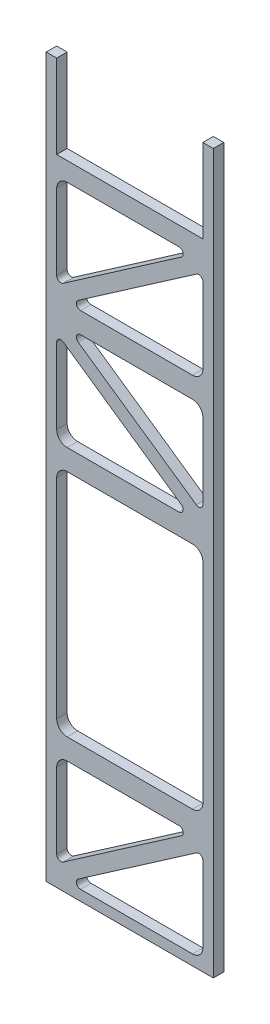
from build123d import *

# Parameters (mm, degrees)
BOSS_EXTRUDE1_DEPTH = 6.35
CUT_EXTRUDE1_START  = -6.35
CUT_EXTRUDE1_DEPTH  = 6.35


with BuildPart() as part:
    # Model → Boss-Extrude1 (new body)
    with BuildSketch(Plane.XY):
        Polygon((-95.25, 386.08), (-6.35, 386.08), (-6.35, 436.88), (0, 436.88), (0, 0), (-101.6, 0), (-101.6, 436.88), (-95.25, 436.88), align=None)
        with BuildLine():
            Line((-80.76878597, 311.15), (-12.7, 311.15))
            ThreePointArc((-12.7, 311.15), (-8.209871939, 313.009871939), (-6.35, 317.5))
            Line((-6.35, 317.5), (-6.35, 363.45223644))
            ThreePointArc((-6.35, 363.45223644), (-7.711169032, 365.702115893), (-10.335793346, 365.540604607))
            Line((-10.335793346, 365.540604607), (-82.214579316, 315.778368167))
            ThreePointArc((-82.214579316, 315.778368167), (-83.193250358, 312.932654354), (-80.76878597, 311.15))
        make_face(mode=Mode.SUBTRACT)
        with BuildLine():
            Line((-95.25, 287.25223644), (-95.25, 241.3))
            ThreePointArc((-95.25, 241.3), (-93.390128061, 236.809871939), (-88.9, 234.95))
            Line((-88.9, 234.95), (-20.83121403, 234.95))
            ThreePointArc((-20.83121403, 234.95), (-18.406749642, 236.732654354), (-19.385420684, 239.578368167))
            Line((-19.385420684, 239.578368167), (-91.264206654, 289.340604607))
            ThreePointArc((-91.264206654, 289.340604607), (-93.888830968, 289.502115893), (-95.25, 287.25223644))
        make_face(mode=Mode.SUBTRACT)
        with BuildLine():
            Line((-80.76878597, 158.75), (-12.7, 158.75))
            ThreePointArc((-12.7, 158.75), (-8.209871939, 160.609871939), (-6.35, 165.1))
            Line((-6.35, 165.1), (-6.35, 211.05223644))
            ThreePointArc((-6.35, 211.05223644), (-7.711169032, 213.302115893), (-10.335793346, 213.140604607))
            Line((-10.335793346, 213.140604607), (-82.214579316, 163.378368167))
            ThreePointArc((-82.214579316, 163.378368167), (-83.193250358, 160.532654354), (-80.76878597, 158.75))
        make_face(mode=Mode.SUBTRACT)
        with BuildLine():
            Line((-20.83121403, 222.25), (-88.9, 222.25))
            ThreePointArc((-88.9, 222.25), (-93.390128061, 220.390128061), (-95.25, 215.9))
            Line((-95.25, 215.9), (-95.25, 169.94776356))
            ThreePointArc((-95.25, 169.94776356), (-93.888830968, 167.697884107), (-91.264206654, 167.859395393))
            Line((-91.264206654, 167.859395393), (-19.385420684, 217.621631833))
            ThreePointArc((-19.385420684, 217.621631833), (-18.406749642, 220.467345646), (-20.83121403, 222.25))
        make_face(mode=Mode.SUBTRACT)
        with BuildLine():
            Line((-82.214579316, 293.821631833), (-10.335793346, 244.059395393))
            ThreePointArc((-10.335793346, 244.059395393), (-7.711169032, 243.897884107), (-6.35, 246.14776356))
            Line((-6.35, 246.14776356), (-6.35, 292.1))
            ThreePointArc((-6.35, 292.1), (-8.209871939, 296.590128061), (-12.7, 298.45))
            Line((-12.7, 298.45), (-80.76878597, 298.45))
            ThreePointArc((-80.76878597, 298.45), (-83.193250358, 296.667345646), (-82.214579316, 293.821631833))
        make_face(mode=Mode.SUBTRACT)
        with BuildLine():
            Line((-95.25, 134.85223644), (-95.25, 88.9))
            ThreePointArc((-95.25, 88.9), (-93.390128061, 84.409871939), (-88.9, 82.55))
            Line((-88.9, 82.55), (-20.83121403, 82.55))
            ThreePointArc((-20.83121403, 82.55), (-18.406749642, 84.332654354), (-19.385420684, 87.178368167))
            Line((-19.385420684, 87.178368167), (-91.264206654, 136.940604607))
            ThreePointArc((-91.264206654, 136.940604607), (-93.888830968, 137.102115893), (-95.25, 134.85223644))
        make_face(mode=Mode.SUBTRACT)
        with BuildLine():
            Line((-80.76878597, 6.35), (-12.7, 6.35))
            ThreePointArc((-12.7, 6.35), (-8.209871939, 8.209871939), (-6.35, 12.7))
            Line((-6.35, 12.7), (-6.35, 58.65223644))
            ThreePointArc((-6.35, 58.65223644), (-7.711169032, 60.902115893), (-10.335793346, 60.740604607))
            Line((-10.335793346, 60.740604607), (-82.214579316, 10.978368167))
            ThreePointArc((-82.214579316, 10.978368167), (-83.193250358, 8.132654354), (-80.76878597, 6.35))
        make_face(mode=Mode.SUBTRACT)
        with BuildLine():
            Line((-20.83121403, 69.85), (-88.9, 69.85))
            ThreePointArc((-88.9, 69.85), (-93.390128061, 67.990128061), (-95.25, 63.5))
            Line((-95.25, 63.5), (-95.25, 17.54776356))
            ThreePointArc((-95.25, 17.54776356), (-93.888830968, 15.297884107), (-91.264206654, 15.459395393))
            Line((-91.264206654, 15.459395393), (-19.385420684, 65.221631833))
            ThreePointArc((-19.385420684, 65.221631833), (-18.406749642, 68.067345646), (-20.83121403, 69.85))
        make_face(mode=Mode.SUBTRACT)
        with BuildLine():
            Line((-20.83121403, 374.65), (-88.9, 374.65))
            ThreePointArc((-88.9, 374.65), (-93.390128061, 372.790128061), (-95.25, 368.3))
            Line((-95.25, 368.3), (-95.25, 322.34776356))
            ThreePointArc((-95.25, 322.34776356), (-93.888830968, 320.097884107), (-91.264206654, 320.259395393))
            Line((-91.264206654, 320.259395393), (-19.385420684, 370.021631833))
            ThreePointArc((-19.385420684, 370.021631833), (-18.406749642, 372.867345646), (-20.83121403, 374.65))
        make_face(mode=Mode.SUBTRACT)
        with BuildLine():
            Line((-82.214579316, 141.421631833), (-10.335793346, 91.659395393))
            ThreePointArc((-10.335793346, 91.659395393), (-7.711169032, 91.497884107), (-6.35, 93.74776356))
            Line((-6.35, 93.74776356), (-6.35, 139.7))
            ThreePointArc((-6.35, 139.7), (-8.209871939, 144.190128061), (-12.7, 146.05))
            Line((-12.7, 146.05), (-80.76878597, 146.05))
            ThreePointArc((-80.76878597, 146.05), (-83.193250358, 144.267345646), (-82.214579316, 141.421631833))
        make_face(mode=Mode.SUBTRACT)
    extrude(amount=BOSS_EXTRUDE1_DEPTH)

    # Sketch1 → Cut-Extrude1 (cut)
    with BuildSketch(Plane.XY.offset(6.35).offset(CUT_EXTRUDE1_START)):
        with BuildLine():
            Line((-12.7, 82.55), (-88.9, 82.55))
            ThreePointArc((-88.9, 82.55), (-93.390128061, 84.409871939), (-95.25, 88.9))
            Line((-95.25, 88.9), (-95.25, 215.9))
            ThreePointArc((-95.25, 215.9), (-93.390128061, 220.390128061), (-88.9, 222.25))
            Line((-88.9, 222.25), (-12.7, 222.25))
            ThreePointArc((-12.7, 222.25), (-8.209871939, 220.390128061), (-6.35, 215.9))
            Line((-6.35, 215.9), (-6.35, 88.9))
            ThreePointArc((-6.35, 88.9), (-8.209871939, 84.409871939), (-12.7, 82.55))
        make_face()
    extrude(amount=CUT_EXTRUDE1_DEPTH, mode=Mode.SUBTRACT)


solid = part.part
